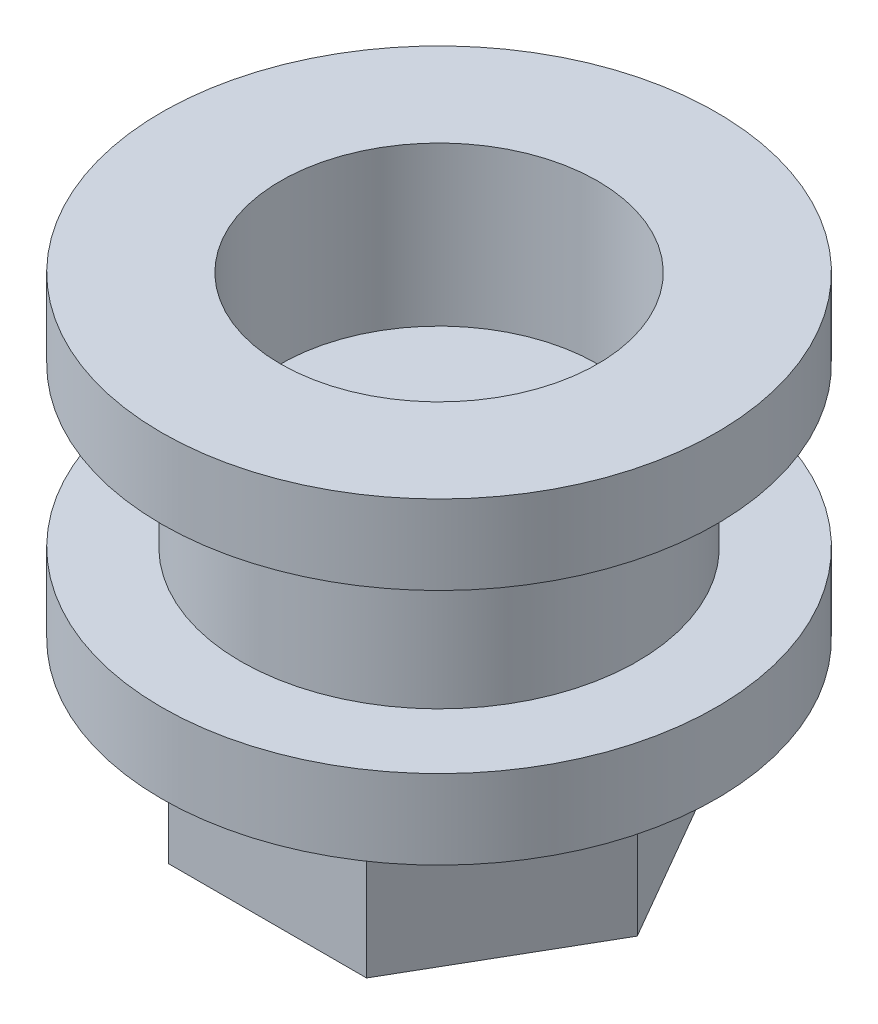
from build123d import *

# Parameters (mm, degrees)
EXTRUDE_1_DEPTH     = 4
SKETCH_4_R          = 1.5
CUT_EXTRUDE_1_DEPTH = 15
SKETCH_3_R          = 7
EXTRUDE_4_DEPTH     = 2
SKETCH_10_R         = 5
EXTRUDE_7_DEPTH     = 4
SKETCH_11_R         = 7
EXTRUDE_8_DEPTH     = 2
SKETCH_12_R         = 4
CUT_EXTRUDE_5_DEPTH = 4


with BuildPart() as part:
    # 草图2 → 凸台-拉伸1 (new body)
    with BuildSketch(Plane(origin=(0, 0, 0), x_dir=(1, 0, 0), z_dir=(0, 1, 0))):
        Polygon((0, 0), (-2.5, 4.330127019), (-5, 0), align=None)
        Polygon((-2.5, -4.330127019), (-5, 0), (0, 0), align=None)
        Polygon((0, 0), (-2.5, -4.330127019), (2.5, -4.330127019), align=None)
        Polygon((0, 0), (2.5, -4.330127019), (5, 0), align=None)
        Polygon((0, 0), (5, 0), (2.5, 4.330127019), align=None)
        Polygon((0, 0), (2.5, 4.330127019), (-2.5, 4.330127019), align=None)
    extrude(amount=EXTRUDE_1_DEPTH)

    # 草图4 → 切除-拉伸1 (cut)
    with BuildSketch(Plane.XZ):
        with Locations(Location((0, 0, 0), (0, 0, 270))):
            Circle(SKETCH_4_R)
    extrude(amount=-CUT_EXTRUDE_1_DEPTH, mode=Mode.SUBTRACT)

    # 草图3 → 凸台-拉伸4 (add)
    with BuildSketch(Plane(origin=(0, 4, 0), x_dir=(1, 0, 0), z_dir=(0, 1, 0))):
        with Locations(Location((0, 0, 0), (0, 0, 270))):
            Circle(SKETCH_3_R)
    extrude(amount=EXTRUDE_4_DEPTH)

    # 草图10 → 凸台-拉伸7 (add)
    with BuildSketch(Plane(origin=(0, 6, 0), x_dir=(1, 0, 0), z_dir=(0, 1, 0))):
        with Locations(Location((0, 0, 0), (0, 0, 270))):
            Circle(SKETCH_10_R)
    extrude(amount=EXTRUDE_7_DEPTH)

    # 草图11 → 凸台-拉伸8 (add)
    with BuildSketch(Plane(origin=(0, 10, 0), x_dir=(1, 0, 0), z_dir=(0, 1, 0))):
        with Locations(Location((0, 0, 0), (0, 0, 270))):
            Circle(SKETCH_11_R)
    extrude(amount=EXTRUDE_8_DEPTH)

    # 草图12 → 切除-拉伸5 (cut)
    with BuildSketch(Plane(origin=(0, 12, 0), x_dir=(1, 0, 0), z_dir=(0, 1, 0))):
        with Locations(Location((0, 0, 0), (0, 0, 270))):
            Circle(SKETCH_12_R)
    extrude(amount=-CUT_EXTRUDE_5_DEPTH, mode=Mode.SUBTRACT)


solid = part.part
